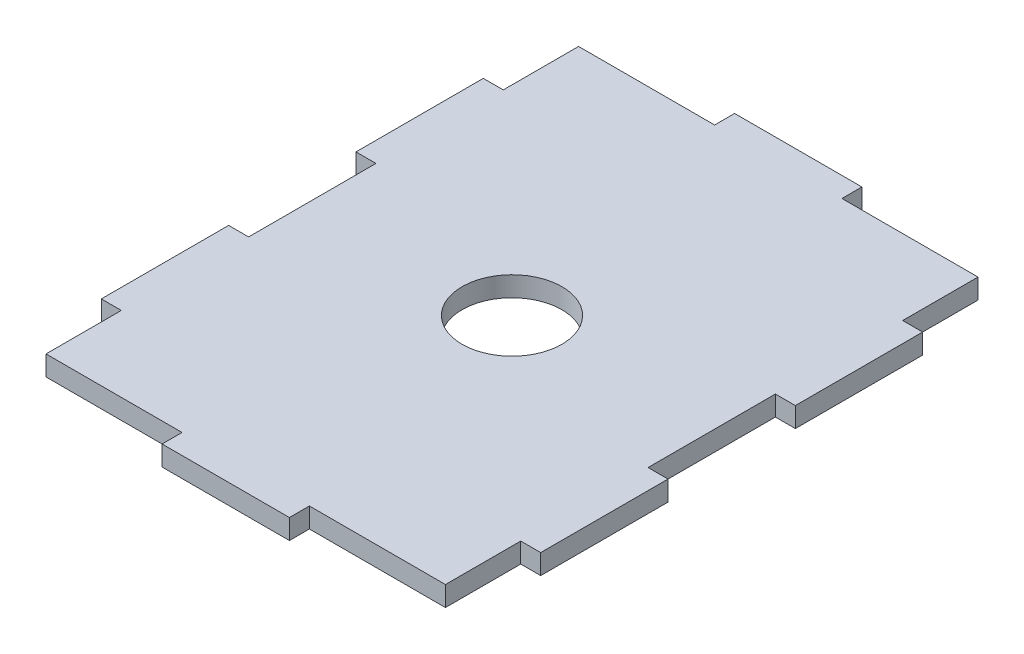
from build123d import *

# Parameters (mm, degrees)
SKETCH1_R           = 7.5
BOSS_EXTRUDE1_DEPTH = 3


with BuildPart() as part:
    # Sketch1 → Boss-Extrude1 (new body)
    with BuildSketch(Plane(origin=(0, 0, 0), x_dir=(1, 0, 0), z_dir=(0, 1, 0))):
        Polygon((-13.885581934, -10.773206129), (-13.885581934, -22.085706129), (-16.885581934, -22.085706129), (-16.885581934, -41.210706129), (-13.885581934, -41.210706129), (-13.885581934, -60.335706129), (-16.885581934, -60.335706129), (-16.885581934, -79.460706129), (-13.885581934, -79.460706129), (-13.885581934, -90.773206129), (6.551918066, -90.773206129), (6.551918066, -93.773206129), (25.676918066, -93.773206129), (25.676918066, -90.773206129), (44.801918066, -90.773206129), (46.114418066, -90.773206129), (46.114418066, -79.460706129), (49.114418066, -79.460706129), (49.114418066, -60.335706129), (46.114418066, -60.335706129), (46.114418066, -41.210706129), (49.114418066, -41.210706129), (49.114418066, -22.085706129), (46.114418066, -22.085706129), (46.114418066, -10.773206129), (25.676918066, -10.773206129), (25.676918066, -7.773206129), (6.551918066, -7.773206129), (6.551918066, -10.773206129), (-12.573081934, -10.773206129), align=None)
        with Locations(Location((16.114418066, -50.773206129, 0), (0, 0, 270))):
            Circle(SKETCH1_R, mode=Mode.SUBTRACT)
    extrude(amount=BOSS_EXTRUDE1_DEPTH)


solid = part.part
